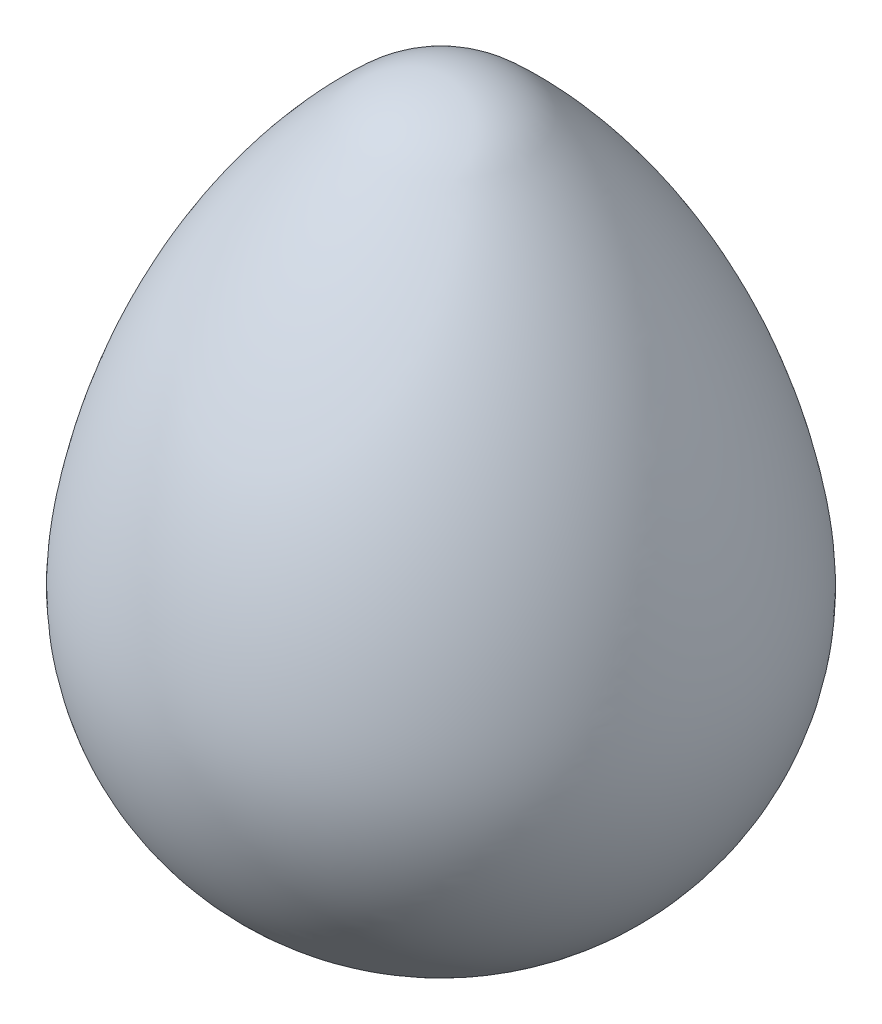
from build123d import *


with BuildPart() as part:
    # Sketch1 → Revolve1 (revolve)
    with BuildSketch(Plane.XY):
        with BuildLine():
            Line((0, 27.5), (0, -17.5))
            add(Edge.make_bspline(
                [(0, 27.5), (1.392538888, 27.5), (2.73081119, 27.115043116), (3.910513218, 26.375132525), (4.168595109, 26.21326324), (4.664657949, 25.857476038), (5.338032996, 25.228968144), (5.775548453, 24.804868642), (5.991855463, 24.590347768), (10.34595172, 20.272205075), (13.611531577, 15.081781324), (15.619626567, 9.287640746), (16.126464658, 7.825214336), (16.970378931, 4.841526555), (17.708906175, 0.004427467), (17.29433091, -3.090581537), (16.888878754, -4.584296504), (14.737343228, -12.510708461), (8.213227844, -17.5), (0, -17.5)],
                knots=[0, 0, 0, 0, 0.067725862, 0.067725862, 0.067725862, 0.082937351, 0.09814884, 0.113360329, 0.113360329, 0.113360329, 0.414274996, 0.414274996, 0.414274996, 0.491558029, 0.568841062, 0.646124094, 0.646124094, 0.646124094, 1, 1, 1, 1], degree=3, weights=[1, 0.974020313, 0.974020313, 1, 1, 1, 1, 1, 1, 0.982752581, 0.982752581, 1, 1, 1, 1, 1, 1, 0.862894955, 0.862894955, 1]))
        make_face()
    revolve(axis=Axis((0, 0, 0), (0, 1, 0)))


solid = part.part
